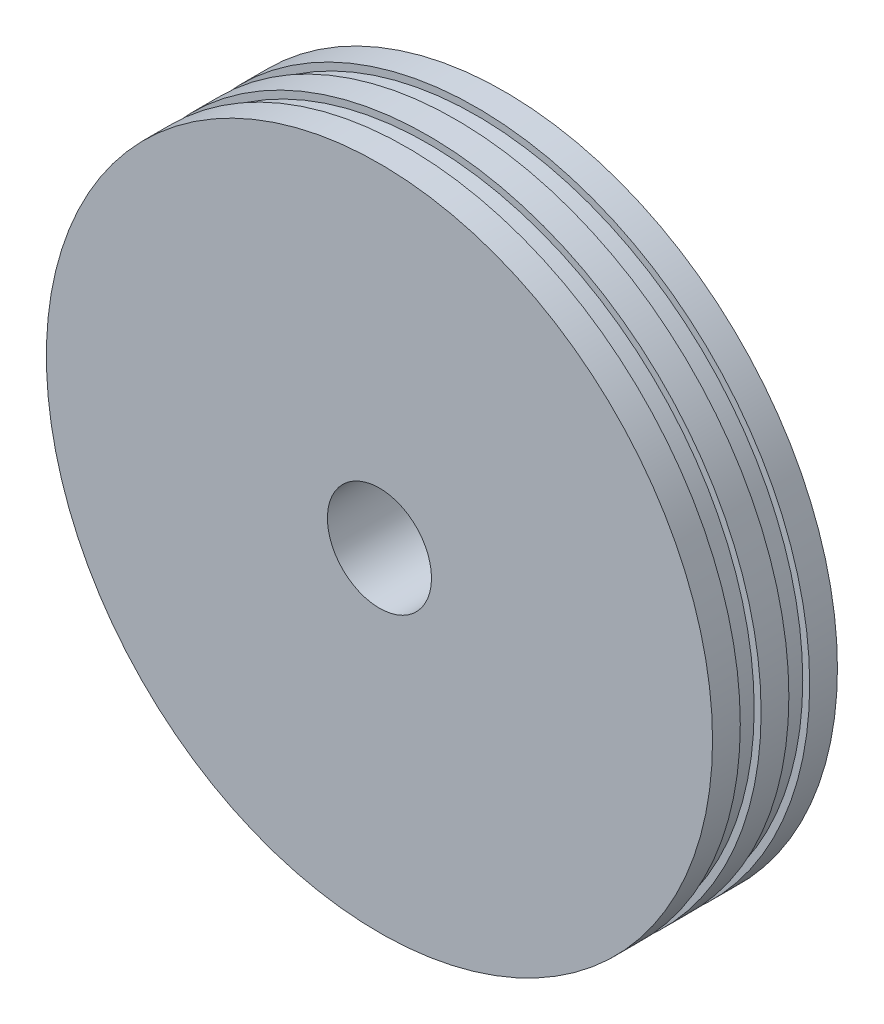
from build123d import *

# Parameters (mm, degrees)
SKETCH1_R           = 120
BOSS_EXTRUDE2_DEPTH = 10
SKETCH2_R           = 117.5
BOSS_EXTRUDE3_DEPTH = 7.5
SKETCH3_R           = 120
BOSS_EXTRUDE4_DEPTH = 10
SKETCH4_R           = 117.5
BOSS_EXTRUDE5_DEPTH = 7.5
SKETCH5_R           = 120
BOSS_EXTRUDE6_DEPTH = 10
SKETCH6_R           = 18.75
CUT_EXTRUDE1_DEPTH  = 50


with BuildPart() as part:
    # Sketch1 → Boss-Extrude2 (new body)
    with BuildSketch(Plane.XY):
        Circle(SKETCH1_R)
    extrude(amount=BOSS_EXTRUDE2_DEPTH)

    # Sketch2 → Boss-Extrude3 (add)
    with BuildSketch(Plane.XY.offset(10)):
        Circle(SKETCH2_R)
    extrude(amount=BOSS_EXTRUDE3_DEPTH)

    # Sketch3 → Boss-Extrude4 (add)
    with BuildSketch(Plane.XY.offset(17.5)):
        Circle(SKETCH3_R)
    extrude(amount=BOSS_EXTRUDE4_DEPTH)

    # Sketch4 → Boss-Extrude5 (add)
    with BuildSketch(Plane.XY.offset(27.5)):
        Circle(SKETCH4_R)
    extrude(amount=BOSS_EXTRUDE5_DEPTH)

    # Sketch5 → Boss-Extrude6 (add)
    with BuildSketch(Plane.XY.offset(35)):
        Circle(SKETCH5_R)
    extrude(amount=BOSS_EXTRUDE6_DEPTH)

    # Sketch6 → Cut-Extrude1 (cut)
    with BuildSketch(Plane.XY.offset(45)):
        Circle(SKETCH6_R)
    extrude(amount=-CUT_EXTRUDE1_DEPTH, mode=Mode.SUBTRACT)


solid = part.part
